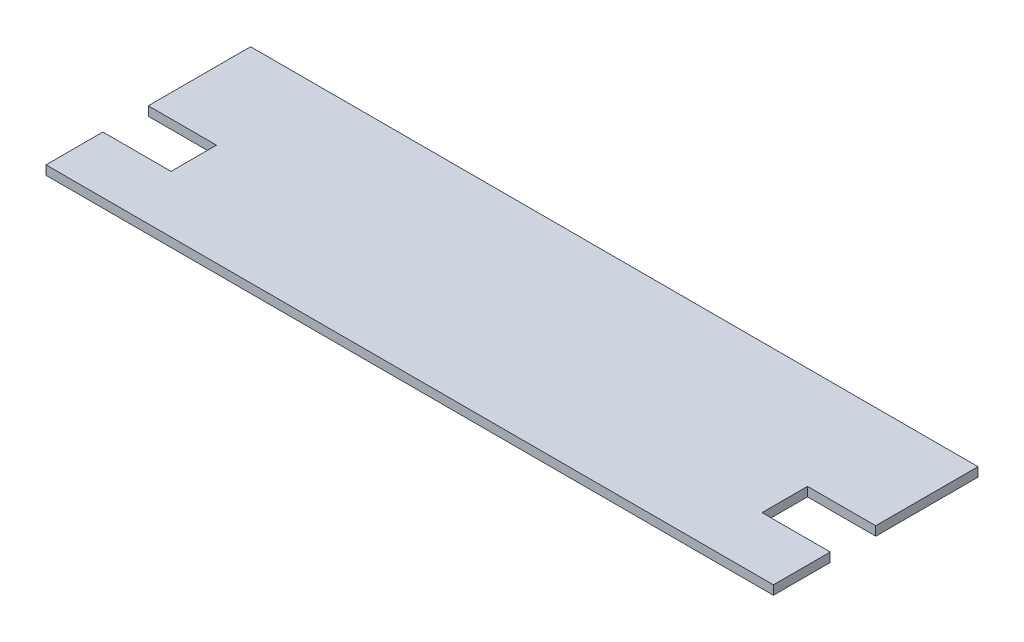
from build123d import *

# Parameters (mm, degrees)
SKETCH_1_W          = 320
SKETCH_1_H          = 90
EXTRUDE_1_DEPTH     = 4
SKETCH_2_W          = 30
SKETCH_2_H          = 20
CUT_EXTRUDE_1_DEPTH = 333.439468174


with BuildPart() as part:
    # 草图1 → 凸台-拉伸1 (new body)
    with BuildSketch(Plane(origin=(0, 0, 0), x_dir=(1, 0, 0), z_dir=(0, 1, 0))):
        with Locations((160, 45)):
            Rectangle(SKETCH_1_W, SKETCH_1_H)
    extrude(amount=EXTRUDE_1_DEPTH)

    # 草图2 → 切除-拉伸1 (cut, through all)
    with BuildSketch(Plane(origin=(0, 4, 0), x_dir=(1, 0, 0), z_dir=(0, 1, 0))):
        with Locations((15, 35)):
            Rectangle(SKETCH_2_W, SKETCH_2_H)
        with Locations((305, 35)):
            Rectangle(SKETCH_2_W, SKETCH_2_H)
    extrude(amount=-CUT_EXTRUDE_1_DEPTH, mode=Mode.SUBTRACT)


solid = part.part
